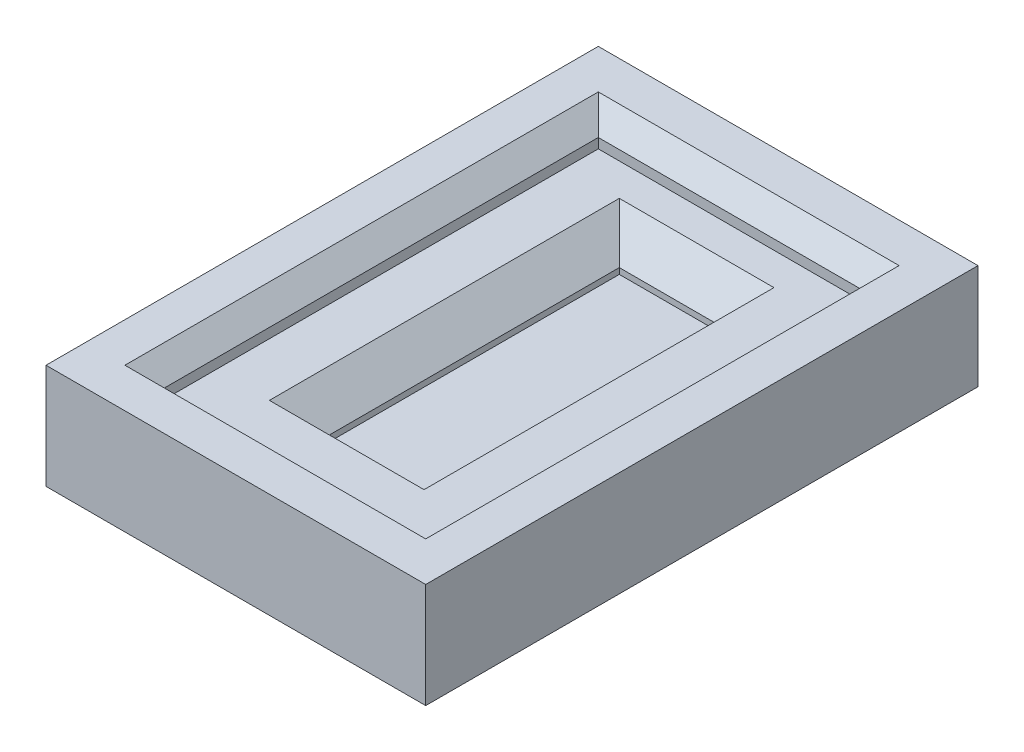
from build123d import *

# Parameters (mm, degrees)
EXTRUDE_1_DEPTH = 7000
EXTRUDE_2_REACH = 12196.926


with BuildPart() as part:
    # Эскиз1 → Бобышка-Вытянуть1 (new body)
    with BuildSketch(Plane.XY):
        Polygon((-1200, -1660), (1200, -1660), (1200, -1510), (1960, -750), (3312.5, -750), (3312.5, -500), (3812.5, 0), (4812.5, 0), (4812.5, -2660), (-4812.5, -2660), (-4812.5, 0), (-3812.5, 0), (-3312.5, -500), (-3312.5, -750), (-1960, -750), (-1200, -1510), align=None)
    extrude(amount=EXTRUDE_1_DEPTH)

    # Зеркальное отражение2: part across plane


with BuildPart() as part_1:
    add(part.part)
    add(part.part.mirror(Plane(origin=(0, 0, 0), x_dir=(1, 0, 0), z_dir=(0, 0, -1))))

    # Бобышка-Вытянуть2: up to this face of the body (flat: up to its plane)
    extrude_2_end = Plane(part_1.part.faces().sort_by_distance((4812.5, -1330, 0))[0])
    # Эскиз3 → Бобышка-Вытянуть2 (add, up to the picked face)
    with BuildSketch(Plane.ZY.offset(4812.5), mode=Mode.PRIVATE) as extrude_2_sk1:
        Polygon((-3920, -1660), (3430, -1660), (3430, -1510), (4190, -750), (5500, -750), (5500, -500), (6000, 0), (7000, 0), (7000, -2660), (-7000, -2660), (-7000, 0), (-6000, 0), (-5500, -500), (-5500, -750), (-4680, -750), (-3920, -1510), align=None)
    extrude_2_tool1 = split(extrude(extrude_2_sk1.sketch, amount=-EXTRUDE_2_REACH, mode=Mode.PRIVATE), bisect_by=extrude_2_end, keep=Keep.BOTH, mode=Mode.PRIVATE)
    add(extrude_2_tool1.solids().sort_by(Axis((-4812.5, -1758.162956, 82.900381), (1, 0, 0)))[0])


solid = part_1.part
